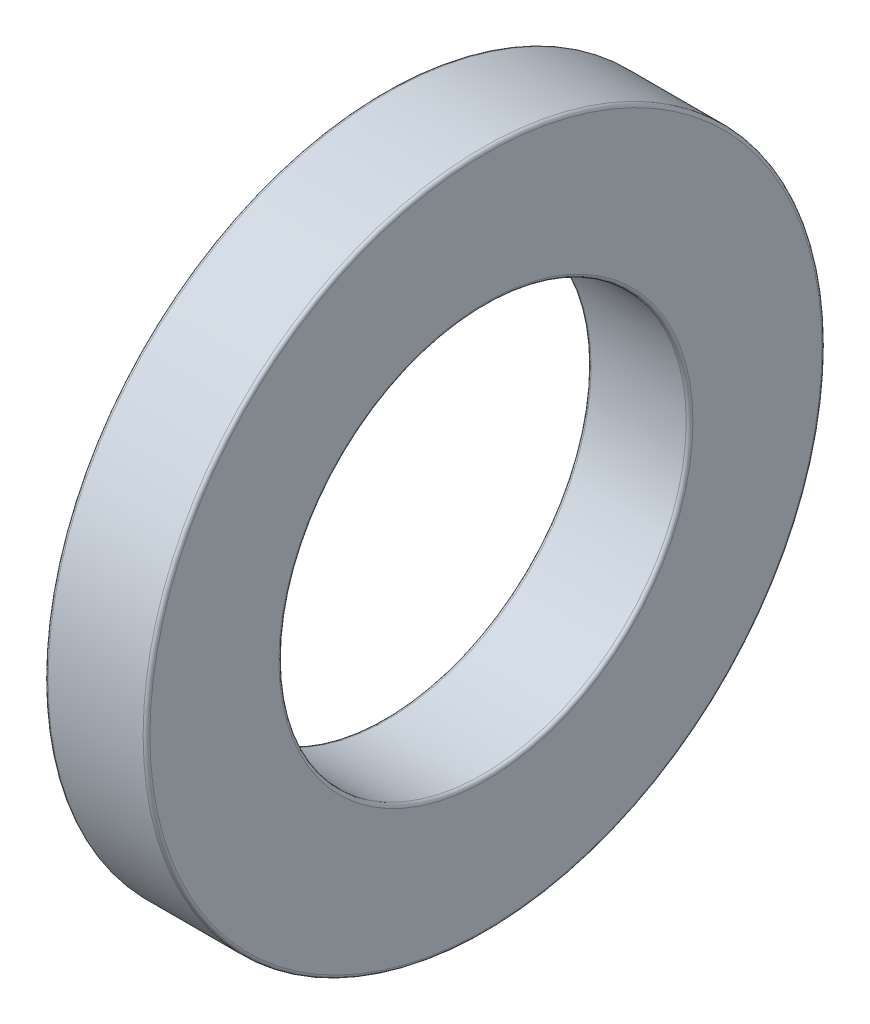
from build123d import *

# Parameters (mm, degrees)
SKETCH1_R           = 5
SKETCH1_R_2         = 3
BOSS_EXTRUDE1_DEPTH = 1.5
FILLET1_R           = 0.05


with BuildPart() as part:
    # Sketch1 → Boss-Extrude1 (new body)
    with BuildSketch(Plane(origin=(0, 0, 0), x_dir=(0, 0, -1), z_dir=(1, 0, 0))):
        Circle(SKETCH1_R)
        Circle(SKETCH1_R_2, mode=Mode.SUBTRACT)
    extrude(amount=BOSS_EXTRUDE1_DEPTH)

    # Fillet1
    fillet1_edges = [part.edges().sort_by_distance(p)[0] for p in [
        (0, 0, 5),
        (1.5, 0, 5),
        (0, 0, 3),
        (1.5, 0, 3),
    ]]
    fillet(fillet1_edges, radius=FILLET1_R)


solid = part.part
